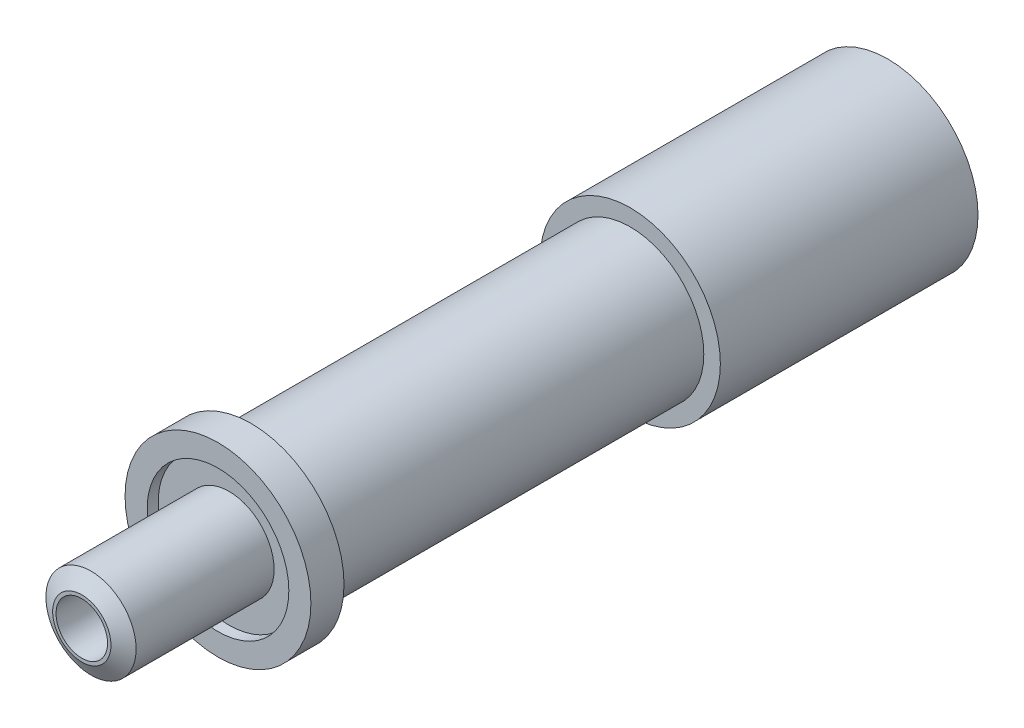
from build123d import *

# Parameters (mm, degrees)
CUT_EXTRUDE1_START = -10
SKETCH2_R          = 5
SKETCH2_R_2        = 2.45
CUT_EXTRUDE1_DEPTH = 10


with BuildPart() as part:
    # Sketch1 → Revolve1 (revolve)
    with BuildSketch(Plane(origin=(0, 0, 0), x_dir=(1, 0, 0), z_dir=(0, 1, 0))):
        with BuildLine():
            Line((0, 24.784048752), (0, 10.1))
            Line((0, 10.1), (0.6, 10.1))
            Line((0.6, 10.1), (0.7, 3.1))
            Line((0.7, 3.1), (0.79197487, 3.1))
            Line((0.79197487, 3.1), (1.225, 3.350011099))
            Line((1.225, 3.350011099), (1.225, 7.1))
            Line((1.225, 7.1), (1.925, 7.1))
            Line((1.925, 7.1), (1.925, 6.8))
            Line((1.925, 6.8), (2.525, 6.8))
            Line((2.525, 6.8), (2.525, 7.7))
            Line((2.525, 7.7), (2, 7.7))
            Line((2, 7.7), (2, 18))
            Line((2, 18), (2.45, 18))
            Line((2.45, 18), (2.45, 24))
            Line((2.45, 24), (4.2, 24))
            Line((4.2, 24), (4.2, 18))
            Line((4.2, 18), (5, 18))
            Line((5, 18), (5, 25))
            ThreePointArc((5, 25), (4.79361011, 25.404713607), (4.344827586, 25.475312026))
            ThreePointArc((4.344827586, 25.475312026), (2.199737011, 24.957944562), (0, 24.784048752))
        make_face()
    revolve(axis=Axis((0, 0, -25.5), (0, 0, 1)))

    # Sketch2 → Cut-Extrude1 (cut)
    with BuildSketch(Plane.XY.offset(-18).offset(CUT_EXTRUDE1_START)):
        Circle(SKETCH2_R)
        Circle(SKETCH2_R_2, mode=Mode.SUBTRACT)
    extrude(amount=CUT_EXTRUDE1_DEPTH, mode=Mode.SUBTRACT)


solid = part.part
